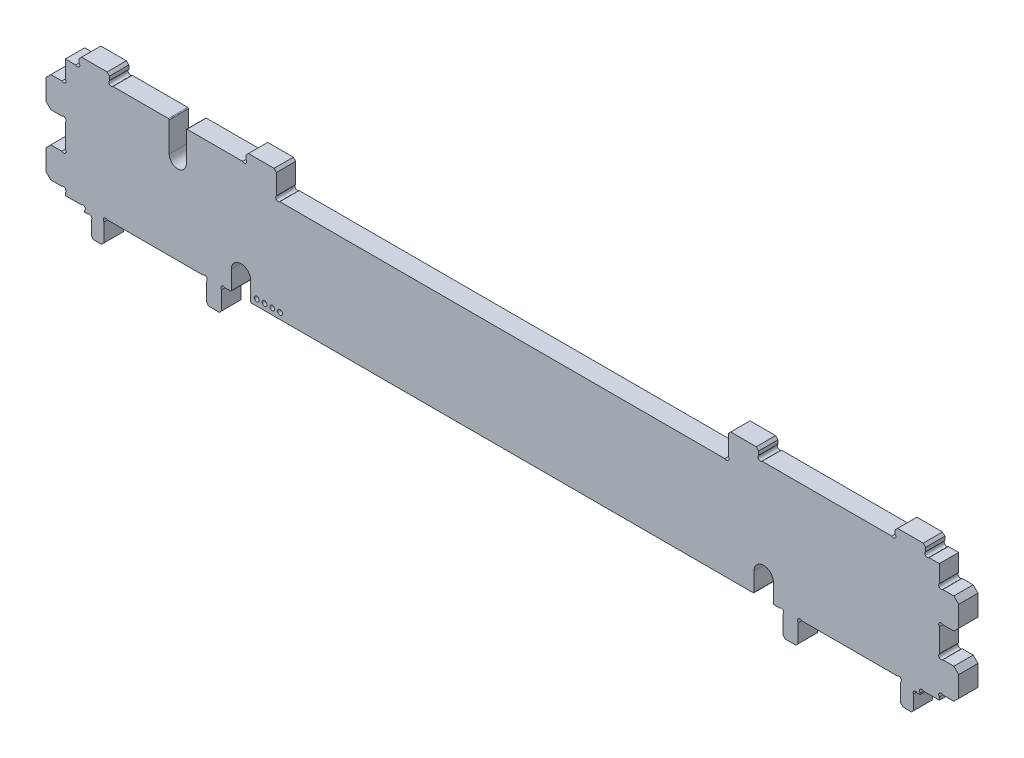
from build123d import *

# Parameters (mm, degrees)
BOSS_EXTRUDE1_DEPTH = 6.35
CUT_EXTRUDE2_DEPTH  = 169.008101823
CUT_EXTRUDE3_DEPTH  = 169.008101823
CUT_EXTRUDE4_DEPTH  = 169.008101823
FILLET1_R           = 0.254
SKETCH7_R           = 0.79375
CUT_EXTRUDE5_DEPTH  = 2.54
LPATTERN1_COUNT     = 4
LPATTERN1_PITCH     = 2.54


with BuildPart() as part:
    # Model → Boss-Extrude1 (new body)
    with BuildSketch(Plane.XY):
        with BuildLine():
            Line((138.15521867, -67.612541882), (138.94896867, -66.818791882))
            Line((138.94896867, -66.818791882), (138.94896867, -62.385073899))
            ThreePointArc((138.94896867, -62.385073899), (138.948968669, -61.262541883), (140.071500684, -61.262541882))
            Line((140.071500684, -61.262541882), (140.971545702, -61.262541882))
            Line((140.971545702, -61.262541882), (140.971545702, -60.810273899))
            ThreePointArc((140.971545702, -60.810273899), (140.9715457, -59.687741883), (142.094077716, -59.687741882))
            Line((142.094077716, -59.687741882), (147.321545702, -59.687741882))
            Line((147.321545702, -59.687741882), (147.321545702, -58.735073899))
            ThreePointArc((147.321545702, -58.735073899), (147.3215457, -57.612541883), (148.444077716, -57.612541882))
            Line((148.444077716, -57.612541882), (152.084045702, -57.612541882))
            Line((152.084045702, -57.612541882), (153.671545702, -56.025041882))
            Line((153.671545702, -56.025041882), (153.671545702, -49.200041882))
            Line((153.671545702, -49.200041882), (152.084045702, -47.612541882))
            Line((152.084045702, -47.612541882), (148.444077716, -47.612541882))
            ThreePointArc((148.444077716, -47.612541882), (147.321545702, -47.612541882), (147.321545702, -46.490009867))
            Line((147.321545702, -46.490009867), (147.321545702, -38.735073899))
            ThreePointArc((147.321545702, -38.735073899), (147.3215457, -37.612541883), (148.444077716, -37.612541882))
            Line((148.444077716, -37.612541882), (152.084045702, -37.612541882))
            Line((152.084045702, -37.612541882), (153.671545702, -36.025041882))
            Line((153.671545702, -36.025041882), (153.671545702, -29.200041882))
            Line((153.671545702, -29.200041882), (152.084045702, -27.612541882))
            Line((152.084045702, -27.612541882), (148.444077716, -27.612541882))
            ThreePointArc((148.444077716, -27.612541882), (147.321545702, -27.612541882), (147.321545702, -26.490009867))
            Line((147.321545702, -26.490009867), (147.321545702, -20.787541882))
            Line((147.321545702, -20.787541882), (143.919077716, -20.787541882))
            ThreePointArc((143.919077716, -20.787541882), (142.796545702, -20.787541882), (142.796545702, -19.665009867))
            Line((142.796545702, -19.665009867), (142.796545702, -18.406291882))
            Line((142.796545702, -18.406291882), (142.002795702, -17.612541882))
            Line((142.002795702, -17.612541882), (133.590295702, -17.612541882))
            Line((133.590295702, -17.612541882), (132.796545702, -18.406291882))
            Line((132.796545702, -18.406291882), (132.796545702, -19.665009867))
            ThreePointArc((132.796545702, -19.665009867), (132.796545702, -20.787541882), (131.674013687, -20.787541882))
            Line((131.674013687, -20.787541882), (89.055077716, -20.787541882))
            ThreePointArc((89.055077716, -20.787541882), (87.932545702, -20.787541882), (87.932545702, -19.665009867))
            Line((87.932545702, -19.665009867), (87.932545702, -18.406291882))
            Line((87.932545702, -18.406291882), (87.138795702, -17.612541882))
            Line((87.138795702, -17.612541882), (78.726295702, -17.612541882))
            Line((78.726295702, -17.612541882), (77.932545702, -18.406291882))
            Line((77.932545702, -18.406291882), (77.932545702, -25.037209867))
            ThreePointArc((77.932545702, -25.037209867), (77.932545702, -26.159741882), (76.810013687, -26.159741882))
            Line((76.810013687, -26.159741882), (-69.46692228, -26.159741882))
            ThreePointArc((-69.46692228, -26.159741882), (-70.589454296, -26.159741883), (-70.589454297, -25.037209867))
            Line((-70.589454297, -25.037209867), (-70.589454297, -18.406291882))
            Line((-70.589454297, -18.406291882), (-71.383204297, -17.612541882))
            Line((-71.383204297, -17.612541882), (-79.795704297, -17.612541882))
            Line((-79.795704297, -17.612541882), (-80.589454297, -18.406291882))
            Line((-80.589454297, -18.406291882), (-80.589454297, -19.665009867))
            ThreePointArc((-80.589454297, -19.665009867), (-80.589454297, -20.787541882), (-81.711986312, -20.787541882))
            Line((-81.711986312, -20.787541882), (-100.521454296, -20.787541882))
            Line((-100.521454296, -20.787541882), (-100.521454296, -29.665009867))
            ThreePointArc((-100.521454296, -29.665009867), (-100.521454296, -30.787541882), (-101.64398631, -30.787541882))
            Line((-101.64398631, -30.787541882), (-104.398922281, -30.787541882))
            ThreePointArc((-104.398922281, -30.787541882), (-105.521454296, -30.787541882), (-105.521454296, -29.665009867))
            Line((-105.521454296, -29.665009867), (-105.521454296, -20.787541882))
            Line((-105.521454296, -20.787541882), (-124.33092228, -20.787541882))
            ThreePointArc((-124.33092228, -20.787541882), (-125.453454296, -20.787541883), (-125.453454297, -19.665009867))
            Line((-125.453454297, -19.665009867), (-125.453454297, -18.406291882))
            Line((-125.453454297, -18.406291882), (-126.247204297, -17.612541882))
            Line((-126.247204297, -17.612541882), (-134.659704297, -17.612541882))
            Line((-134.659704297, -17.612541882), (-135.453454297, -18.406291882))
            Line((-135.453454297, -18.406291882), (-135.453454297, -19.665009867))
            ThreePointArc((-135.453454297, -19.665009867), (-135.453454297, -20.787541882), (-136.575986312, -20.787541882))
            Line((-136.575986312, -20.787541882), (-139.978454297, -20.787541882))
            Line((-139.978454297, -20.787541882), (-139.978454297, -26.490009867))
            ThreePointArc((-139.978454297, -26.490009867), (-139.978454297, -27.612541882), (-141.100986312, -27.612541882))
            Line((-141.100986312, -27.612541882), (-144.740954297, -27.612541882))
            Line((-144.740954297, -27.612541882), (-146.328454297, -29.200041882))
            Line((-146.328454297, -29.200041882), (-146.328454297, -36.025041882))
            Line((-146.328454297, -36.025041882), (-144.740954297, -37.612541882))
            Line((-144.740954297, -37.612541882), (-141.100986312, -37.612541882))
            ThreePointArc((-141.100986312, -37.612541882), (-139.978454296, -37.612541883), (-139.978454297, -38.735073899))
            Line((-139.978454297, -38.735073899), (-139.978454297, -46.490009867))
            ThreePointArc((-139.978454297, -46.490009867), (-139.978454297, -47.612541882), (-141.100986312, -47.612541882))
            Line((-141.100986312, -47.612541882), (-144.740954297, -47.612541882))
            Line((-144.740954297, -47.612541882), (-146.328454297, -49.200041882))
            Line((-146.328454297, -49.200041882), (-146.328454297, -56.025041882))
            Line((-146.328454297, -56.025041882), (-144.740954297, -57.612541882))
            Line((-144.740954297, -57.612541882), (-141.100986312, -57.612541882))
            ThreePointArc((-141.100986312, -57.612541882), (-139.978454296, -57.612541883), (-139.978454297, -58.735073899))
            Line((-139.978454297, -58.735073899), (-139.978454297, -59.687741882))
            Line((-139.978454297, -59.687741882), (-134.750986312, -59.687741882))
            ThreePointArc((-134.750986312, -59.687741882), (-133.628454296, -59.687741883), (-133.628454297, -60.810273899))
            Line((-133.628454297, -60.810273899), (-133.628454297, -61.262541882))
            Line((-133.628454297, -61.262541882), (-132.630226339, -61.262541882))
            ThreePointArc((-132.630226339, -61.262541882), (-131.507694322, -61.262541882), (-131.507694322, -62.385073899))
            Line((-131.507694322, -62.385073899), (-131.507694322, -66.818791882))
            Line((-131.507694322, -66.818791882), (-130.713944322, -67.612541882))
            Line((-130.713944322, -67.612541882), (-128.072204297, -67.612541882))
            Line((-128.072204297, -67.612541882), (-127.278454297, -66.818791882))
            Line((-127.278454297, -66.818791882), (-127.278454297, -60.810273899))
            ThreePointArc((-127.278454297, -60.810273899), (-127.278454298, -59.687741883), (-126.155922283, -59.687741882))
            Line((-126.155922283, -59.687741882), (-94.70598631, -59.687741882))
            ThreePointArc((-94.70598631, -59.687741882), (-93.583454294, -59.687741883), (-93.583454296, -60.810273899))
            Line((-93.583454296, -60.810273899), (-93.583454296, -66.818791882))
            Line((-93.583454296, -66.818791882), (-92.789704296, -67.612541882))
            Line((-92.789704296, -67.612541882), (-89.377204296, -67.612541882))
            Line((-89.377204296, -67.612541882), (-88.583454296, -66.818791882))
            Line((-88.583454296, -66.818791882), (-88.583454296, -60.810273899))
            ThreePointArc((-88.583454296, -60.810273899), (-88.583454297, -59.687741883), (-87.460922281, -59.687741882))
            Line((-87.460922281, -59.687741882), (94.804013689, -59.687741882))
            ThreePointArc((94.804013689, -59.687741882), (95.926545704, -59.687741883), (95.926545703, -60.810273899))
            Line((95.926545703, -60.810273899), (95.926545703, -66.818791882))
            Line((95.926545703, -66.818791882), (96.720295703, -67.612541882))
            Line((96.720295703, -67.612541882), (100.132795703, -67.612541882))
            Line((100.132795703, -67.612541882), (100.926545703, -66.818791882))
            Line((100.926545703, -66.818791882), (100.926545703, -60.810273899))
            ThreePointArc((100.926545703, -60.810273899), (100.926545702, -59.687741883), (102.049077718, -59.687741882))
            Line((102.049077718, -59.687741882), (133.499013687, -59.687741882))
            ThreePointArc((133.499013687, -59.687741882), (134.621545703, -59.687741883), (134.621545702, -60.810273899))
            Line((134.621545702, -60.810273899), (134.621545702, -66.818791882))
            Line((134.621545702, -66.818791882), (135.415295702, -67.612541882))
            Line((135.415295702, -67.612541882), (138.15521867, -67.612541882))
        make_face()
    extrude(amount=BOSS_EXTRUDE1_DEPTH)

    # Sketch3 → Cut-Extrude2 (cut, through all)
    with BuildSketch(Plane.XY.offset(6.35)):
        with BuildLine():
            Line((-131.355294322, -62.171255574), (-131.355294322, -66.971191882))
            Line((-131.355294322, -66.971191882), (-131.507694322, -66.818791882))
            Line((-131.507694322, -66.818791882), (-131.507694322, -62.385073899))
            ThreePointArc((-131.507694322, -62.385073899), (-131.422591643, -62.284510162), (-131.355294322, -62.171255574))
        make_face()
        with BuildLine():
            Line((138.79656867, -62.171255574), (138.79656867, -66.971191882))
            Line((138.79656867, -66.971191882), (138.94896867, -66.818791882))
            Line((138.94896867, -66.818791882), (138.94896867, -62.385073899))
            ThreePointArc((138.94896867, -62.385073899), (138.86386599, -62.284510163), (138.79656867, -62.171255574))
        make_face()
    extrude(amount=-CUT_EXTRUDE2_DEPTH, mode=Mode.SUBTRACT)

    # Sketch4 → Cut-Extrude3 (cut, through all)
    with BuildSketch(Plane.XY.offset(6.35)):
        with BuildLine():
            Line((-85.408454296, -59.687741882), (-79.058454296, -59.687741882))
            Line((-79.058454296, -59.687741882), (-79.058454296, -53.337741882))
            ThreePointArc((-79.058454296, -53.337741882), (-82.233454296, -50.162741882), (-85.408454296, -53.337741882))
            Line((-85.408454296, -53.337741882), (-85.408454296, -59.687741882))
        make_face()
        with BuildLine():
            Line((86.4015457, -59.687741882), (86.4015457, -53.337741882))
            ThreePointArc((86.4015457, -53.337741882), (89.5765457, -50.162741882), (92.751545701, -53.337741882))
            Line((92.751545701, -53.337741882), (92.751545701, -59.687741882))
            Line((92.751545701, -59.687741882), (86.4015457, -59.687741882))
        make_face()
    extrude(amount=-CUT_EXTRUDE3_DEPTH, mode=Mode.SUBTRACT)

    # Sketch6 → Cut-Extrude4 (cut, through all)
    with BuildSketch(Plane.XY.offset(6.35)):
        with BuildLine():
            Line((-105.833547434, -30.787541882), (-105.833547434, -20.787541882))
            Line((-105.833547434, -20.787541882), (-100.209361158, -20.787541882))
            Line((-100.209361158, -20.787541882), (-100.209361158, -30.787541882))
            ThreePointArc((-100.209361158, -30.787541882), (-103.021454296, -33.59963502), (-105.833547434, -30.787541882))
        make_face()
    extrude(amount=-CUT_EXTRUDE4_DEPTH, mode=Mode.SUBTRACT)

    # Fillet1
    fillet1_edges = [part.edges().sort_by_distance(p)[0] for p in [
        (-85.408454296, -59.687741882, 3.175),
        (-79.058454296, -59.687741882, 3.175),
        (92.751545701, -59.687741882, 3.175),
        (86.4015457, -59.687741882, 3.175),
        (-105.833547434, -20.787541882, 3.175),
        (-100.209361158, -20.787541882, 3.175),
    ]]
    fillet(fillet1_edges, radius=FILLET1_R)

    # Sketch7 → Cut-Extrude5 (cut)
    with BuildSketch(Plane.XY.offset(6.35)):
        with Locations((-77.026454296, -57.655741882)):
            Circle(SKETCH7_R)
    cut_extrude5 = extrude(amount=-CUT_EXTRUDE5_DEPTH, mode=Mode.SUBTRACT)

    # LPattern1: Cut-Extrude5 ×4
    with Locations(*[(i * LPATTERN1_PITCH, 0, 0) for i in range(1, LPATTERN1_COUNT)]):
        add(cut_extrude5, mode=Mode.SUBTRACT)


solid = part.part
